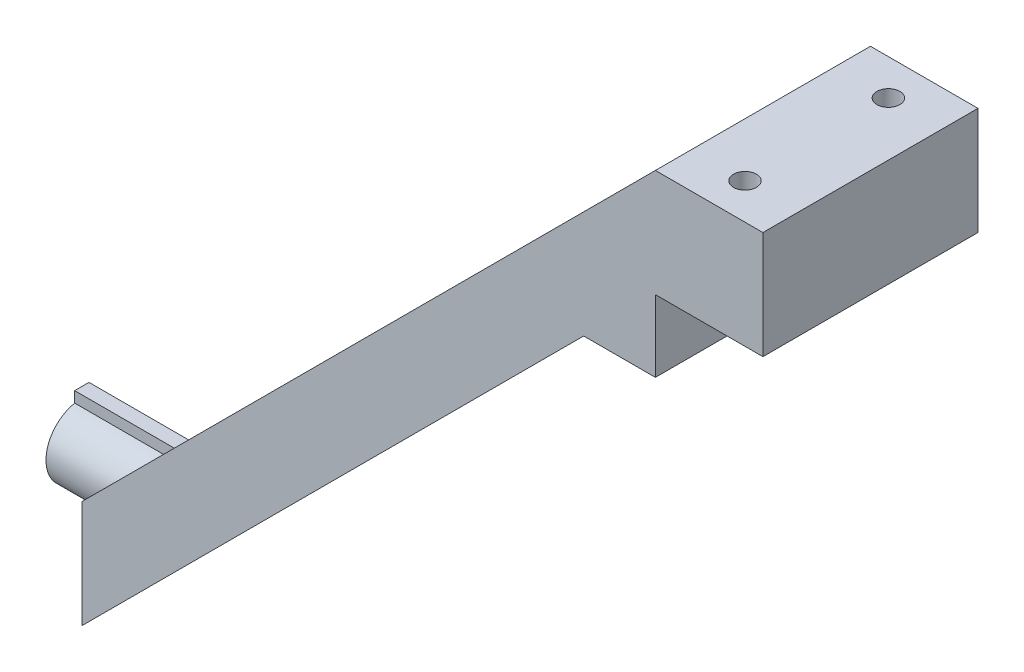
from build123d import *

# Parameters (mm, degrees)
BOSS_EXTRUDE1_DEPTH     = 30
CUT_EXTRUDE1_DEPTH      = 128.769323392
CUT_EXTRUDE1_DEPTH_BACK = 15
SKETCH2_R               = 1.6
BOSS_EXTRUDE2_DEPTH     = 15


with BuildPart() as part:
    # Sketch1 → Boss-Extrude1 (new body)
    with BuildSketch(Plane.XY):
        Polygon((0, 0), (15, 0), (15, -15), (0, -15), (0, -25), (-10, -25), (-80, -95), (-80, -80), align=None)
    extrude(amount=BOSS_EXTRUDE1_DEPTH)

    # Sketch2 → Cut-Extrude1 (cut, two sides: drawn at the far end of the back side and taken through both)
    with BuildSketch(Plane(origin=(0, 0, 0), x_dir=(1, 0, 0), z_dir=(0, 1, 0)).offset(-CUT_EXTRUDE1_DEPTH_BACK)):
        with Locations(Location((7.5, -5, 0), (0, 0, 180))):
            Circle(SKETCH2_R)
        with Locations(Location((7.5, -25, 0), (0, 0, 180))):
            Circle(SKETCH2_R)
    extrude(amount=CUT_EXTRUDE1_DEPTH + CUT_EXTRUDE1_DEPTH_BACK, mode=Mode.SUBTRACT)

    # Sketch3 → Boss-Extrude2 (add)
    with BuildSketch(Plane.ZY.offset(80)):
        with BuildLine():
            Line((14, -82.601020514), (14, -81.101020514))
            Line((14, -81.101020514), (16, -81.101020514))
            Line((16, -81.101020514), (16, -82.601020514))
            ThreePointArc((16, -82.601020514), (15, -92.5), (14, -82.601020514))
        make_face()
    extrude(amount=BOSS_EXTRUDE2_DEPTH)


solid = part.part
